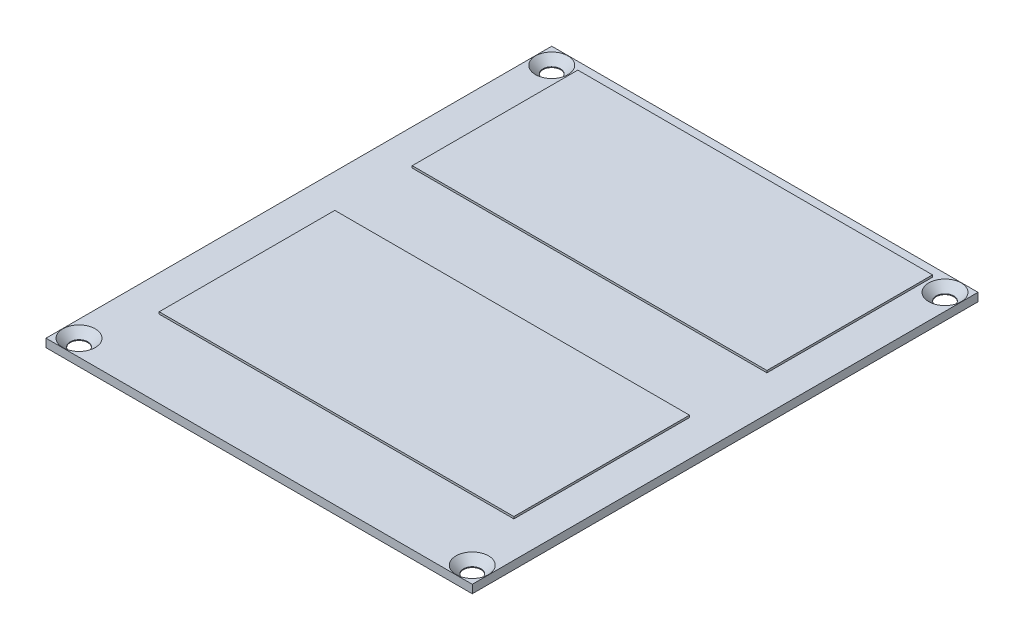
from build123d import *

# Parameters (mm, degrees)
SKETCH1_W                                       = 82.6
SKETCH1_H                                       = 98
SKETCH1_R                                       = 1.6
BOSS_EXTRUDE1_DEPTH                             = 1.6
SKETCH1_3_W                                     = 19.8
SKETCH1_3_H                                     = 3.7
SKETCH1_3_W_2                                   = 17.672668113
SKETCH1_3_W_3                                   = 15.589154013
BOSS_EXTRUDE2_DEPTH                             = 1.6
SKETCH2_W                                       = 68.729308582
SKETCH2_H                                       = 32.090135436
SKETCH2_H_2                                     = 34.029409061
BOSS_EXTRUDE3_DEPTH                             = 0.4
CSK_FOR_M3_FLAT_HEAD_MACHINE_SCREW1_D           = 3.4
CSK_FOR_M3_FLAT_HEAD_MACHINE_SCREW1_DEPTH       = 3.15
CSK_FOR_M3_FLAT_HEAD_MACHINE_SCREW1_CSINK_D     = 6.3
CSK_FOR_M3_FLAT_HEAD_MACHINE_SCREW1_CSINK_ANGLE = 90
CSK_FOR_M3_FLAT_HEAD_MACHINE_SCREW1_TIP         = 1.021463052


with BuildPart() as part:
    # Sketch1 → Boss-Extrude1 (new body)
    with BuildSketch(Plane(origin=(0, 0, 0), x_dir=(1, 0, 0), z_dir=(0, 1, 0))):
        Rectangle(SKETCH1_W, SKETCH1_H)
        with Locations((-38.1, -45.8)):
            Circle(SKETCH1_R, mode=Mode.SUBTRACT)
        with Locations((38.1, -45.8)):
            Circle(SKETCH1_R, mode=Mode.SUBTRACT)
        with Locations((-38.1, 45.8)):
            Circle(SKETCH1_R, mode=Mode.SUBTRACT)
        with Locations((38.1, 45.8)):
            Circle(SKETCH1_R, mode=Mode.SUBTRACT)
    extrude(amount=BOSS_EXTRUDE1_DEPTH)

    # Sketch1<3> → Boss-Extrude2 (add)
    with BuildSketch(Plane(origin=(0, 0, 0), x_dir=(1, 0, 0), z_dir=(0, 1, 0))):
        with Locations((-4.972668113, -38.05)):
            Rectangle(SKETCH1_3_W, SKETCH1_3_H)
        with Locations((15.263665944, -38.05)):
            Rectangle(SKETCH1_3_W_2, SKETCH1_3_H)
        with Locations((16.305422994, -32.85)):
            Rectangle(SKETCH1_3_W_3, SKETCH1_3_H)
    extrude(amount=-BOSS_EXTRUDE2_DEPTH)

    # Sketch2 → Boss-Extrude3 (add)
    with BuildSketch(Plane(origin=(0, 1.6, 0), x_dir=(1, 0, 0), z_dir=(0, 1, 0))):
        with Locations((0, 31.074476779)):
            Rectangle(SKETCH2_W, SKETCH2_H)
        with Locations((0, -16.985295469)):
            Rectangle(SKETCH2_W, SKETCH2_H_2)
    extrude(amount=BOSS_EXTRUDE3_DEPTH)

    # CSK for M3 Flat Head Machine Screw1
    with Locations(Plane(origin=(0, 1.6, 0), x_dir=(1, 0, 0), z_dir=(0, 1, 0))):
        with Locations((-38.1, 45.8), (38.1, 45.8), (38.1, -45.8), (-38.1, -45.8)):
            CounterSinkHole(CSK_FOR_M3_FLAT_HEAD_MACHINE_SCREW1_D / 2, CSK_FOR_M3_FLAT_HEAD_MACHINE_SCREW1_CSINK_D / 2, depth=CSK_FOR_M3_FLAT_HEAD_MACHINE_SCREW1_DEPTH, counter_sink_angle=CSK_FOR_M3_FLAT_HEAD_MACHINE_SCREW1_CSINK_ANGLE)
            with Locations((0, 0, -(CSK_FOR_M3_FLAT_HEAD_MACHINE_SCREW1_DEPTH + CSK_FOR_M3_FLAT_HEAD_MACHINE_SCREW1_TIP / 2))):  # 118° drill point
                Cone(0, CSK_FOR_M3_FLAT_HEAD_MACHINE_SCREW1_D / 2, CSK_FOR_M3_FLAT_HEAD_MACHINE_SCREW1_TIP, mode=Mode.SUBTRACT)


solid = part.part
